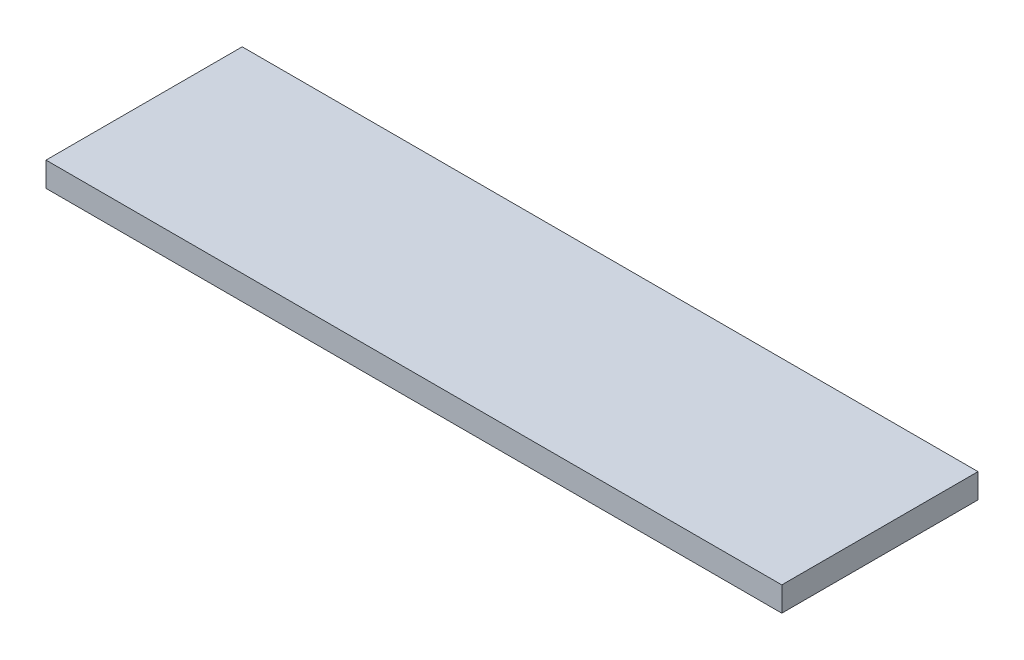
from build123d import *

# Parameters (mm, degrees)
SKETCH1_W           = 30
SKETCH1_H           = 8
BOSS_EXTRUDE1_DEPTH = 1


with BuildPart() as part:
    # Sketch1 → Boss-Extrude1 (new body)
    with BuildSketch(Plane(origin=(0, 0, 0), x_dir=(1, 0, 0), z_dir=(0, 1, 0))):
        Rectangle(SKETCH1_W, SKETCH1_H)
    extrude(amount=BOSS_EXTRUDE1_DEPTH)


solid = part.part
